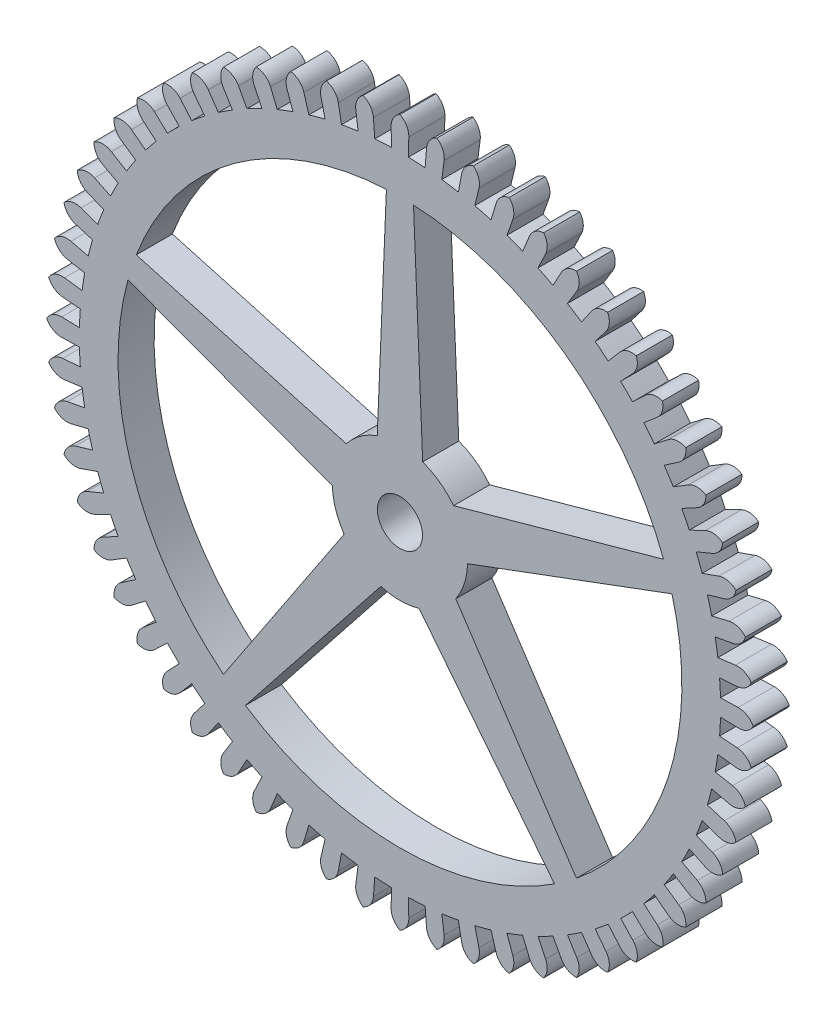
from build123d import *

# Parameters (mm, degrees)
SKETCH1_R           = 0.5
BOSS_EXTRUDE5_DEPTH = 0.8


with BuildPart() as part:
    # Sketch1 → Boss-Extrude5 (new body)
    with BuildSketch(Plane.XY):
        with BuildLine():
            ThreePointArc((-0.196333177, -7.497429779), (-0.145952932, -7.692216353), (0, -7.8307))
            ThreePointArc((0, -7.8307), (0.145952932, -7.692216353), (0.196333177, -7.497429779))
            Line((0.196333177, -7.497429779), (0.186053172, -7.104864355))
            ThreePointArc((0.186053172, -7.104864355), (0.371967342, -7.097559692), (0.5576266, -7.085391017))
            Line((0.5576266, -7.085391017), (0.58843717, -7.476880479))
            ThreePointArc((0.58843717, -7.476880479), (0.658902168, -7.665333823), (0.818531037, -7.787802606))
            ThreePointArc((0.818531037, -7.787802606), (0.949208941, -7.634821352), (0.978952457, -7.435835668))
            Line((0.978952457, -7.435835668), (0.927694506, -7.046495313))
            ThreePointArc((0.927694506, -7.046495313), (1.111826673, -7.019797343), (1.295196897, -6.988288652))
            Line((1.295196897, -6.988288652), (1.366760476, -7.374412912))
            ThreePointArc((1.366760476, -7.374412912), (1.456538198, -7.554468291), (1.628094077, -7.659580417))
            ThreePointArc((1.628094077, -7.659580417), (1.742065219, -7.493777649), (1.750846128, -7.292772987))
            Line((1.750846128, -7.292772987), (1.659171825, -6.910923393))
            ThreePointArc((1.659171825, -6.910923393), (1.839504599, -6.865124625), (2.018576747, -6.814621135))
            Line((2.018576747, -6.814621135), (2.130109268, -7.191149735))
            ThreePointArc((2.130109268, -7.191149735), (2.23821609, -7.360834424), (2.419819378, -7.447438262))
            ThreePointArc((2.419819378, -7.447438262), (2.515835065, -7.270630551), (2.503557163, -7.069809158))
            Line((2.503557163, -7.069809158), (2.37247091, -6.69963395))
            ThreePointArc((2.37247091, -6.69963395), (2.547028528, -6.635236165), (2.719840647, -6.566291202))
            Line((2.719840647, -6.566291202), (2.870120138, -6.929098816))
            ThreePointArc((2.870120138, -6.929098816), (2.995371619, -7.086553715), (3.185032631, -7.153700415))
            ThreePointArc((3.185032631, -7.153700415), (3.262040896, -6.967824903), (3.228838702, -6.769387021))
            Line((3.228838702, -6.769387021), (3.059776708, -6.414941916))
            ThreePointArc((3.059776708, -6.414941916), (3.226646679, -6.332650669), (3.391305404, -6.246019608))
            Line((3.391305404, -6.246019608), (3.57868537, -6.59113124))
            ThreePointArc((3.57868537, -6.59113124), (3.71970923, -6.73463124), (3.91535, -6.781585129))
            ThreePointArc((3.91535, -6.781585129), (3.972507124, -6.588678307), (3.918744408, -6.394798063))
            Line((3.918744408, -6.394798063), (3.713558951, -6.059966436))
            ThreePointArc((3.713558951, -6.059966436), (3.870913014, -5.960683328), (4.02561431, -5.857315317))
            Line((4.02561431, -5.857315317), (4.248041777, -6.180949851))
            ThreePointArc((4.248041777, -6.180949851), (4.403292927, -6.308922735), (4.602769975, -6.335169378))
            ThreePointArc((4.602769975, -6.335169378), (4.639449733, -6.137344773), (4.565715531, -5.950146359))
            Line((4.565715531, -5.950146359), (4.326654666, -5.638596696))
            ThreePointArc((4.326654666, -5.638596696), (4.472768815, -5.523409492), (4.615817742, -5.404437053))
            Line((4.615817742, -5.404437053), (4.870855749, -5.703048682))
            ThreePointArc((4.870855749, -5.703048682), (5.038633226, -5.814092354), (5.239761039, -5.819344185))
            ThreePointArc((5.239761039, -5.819344185), (5.255561559, -5.618769205), (5.162663719, -5.440303606))
            Line((5.162663719, -5.440303606), (4.892346646, -5.15544931))
            ThreePointArc((4.892346646, -5.15544931), (5.025620026, -5.025620026), (5.15544931, -4.892346646))
            Line((5.15544931, -4.892346646), (5.440303606, -5.162663719))
            ThreePointArc((5.440303606, -5.162663719), (5.618769205, -5.255561559), (5.819344185, -5.239761039))
            ThreePointArc((5.819344185, -5.239761039), (5.814092354, -5.038633226), (5.703048682, -4.870855749))
            Line((5.703048682, -4.870855749), (5.404437053, -4.615817742))
            ThreePointArc((5.404437053, -4.615817742), (5.523409492, -4.472768815), (5.638596696, -4.326654666))
            Line((5.638596696, -4.326654666), (5.950146359, -4.565715531))
            ThreePointArc((5.950146359, -4.565715531), (6.137344773, -4.639449733), (6.335169378, -4.602769975))
            ThreePointArc((6.335169378, -4.602769975), (6.308922735, -4.403292927), (6.180949851, -4.248041777))
            Line((6.180949851, -4.248041777), (5.857315317, -4.02561431))
            ThreePointArc((5.857315317, -4.02561431), (5.960683328, -3.870913014), (6.059966436, -3.713558951))
            Line((6.059966436, -3.713558951), (6.394798063, -3.918744408))
            ThreePointArc((6.394798063, -3.918744408), (6.588678307, -3.972507124), (6.781585129, -3.91535))
            ThreePointArc((6.781585129, -3.91535), (6.73463124, -3.71970923), (6.59113124, -3.57868537))
            Line((6.59113124, -3.57868537), (6.246019608, -3.391305404))
            ThreePointArc((6.246019608, -3.391305404), (6.332650669, -3.226646679), (6.414941916, -3.059776708))
            Line((6.414941916, -3.059776708), (6.769387021, -3.228838702))
            ThreePointArc((6.769387021, -3.228838702), (6.967824903, -3.262040896), (7.153700415, -3.185032631))
            ThreePointArc((7.153700415, -3.185032631), (7.086553715, -2.995371619), (6.929098816, -2.870120138))
            Line((6.929098816, -2.870120138), (6.566291202, -2.719840647))
            ThreePointArc((6.566291202, -2.719840647), (6.635236165, -2.547028528), (6.69963395, -2.37247091))
            Line((6.69963395, -2.37247091), (7.069809158, -2.503557163))
            ThreePointArc((7.069809158, -2.503557163), (7.270630551, -2.515835065), (7.447438262, -2.419819378))
            ThreePointArc((7.447438262, -2.419819378), (7.360834424, -2.23821609), (7.191149735, -2.130109268))
            Line((7.191149735, -2.130109268), (6.814621135, -2.018576747))
            ThreePointArc((6.814621135, -2.018576747), (6.865124625, -1.839504599), (6.910923393, -1.659171825))
            Line((6.910923393, -1.659171825), (7.292772987, -1.750846128))
            ThreePointArc((7.292772987, -1.750846128), (7.493777649, -1.742065219), (7.659580417, -1.628094077))
            ThreePointArc((7.659580417, -1.628094077), (7.554468291, -1.456538198), (7.374412912, -1.366760476))
            Line((7.374412912, -1.366760476), (6.988288652, -1.295196897))
            ThreePointArc((6.988288652, -1.295196897), (7.019797343, -1.111826673), (7.046495313, -0.927694506))
            Line((7.046495313, -0.927694506), (7.435835668, -0.978952457))
            ThreePointArc((7.435835668, -0.978952457), (7.634821352, -0.949208941), (7.787802606, -0.818531037))
            ThreePointArc((7.787802606, -0.818531037), (7.665333823, -0.658902168), (7.476880479, -0.58843717))
            Line((7.476880479, -0.58843717), (7.085391017, -0.5576266))
            ThreePointArc((7.085391017, -0.5576266), (7.097559692, -0.371967342), (7.104864355, -0.186053172))
            Line((7.104864355, -0.186053172), (7.497429779, -0.196333177))
            ThreePointArc((7.497429779, -0.196333177), (7.692216353, -0.145952932), (7.8307, 0))
            ThreePointArc((7.8307, 0), (7.692216353, 0.145952932), (7.497429779, 0.196333177))
            Line((7.497429779, 0.196333177), (7.104864355, 0.186053172))
            ThreePointArc((7.104864355, 0.186053172), (7.097559692, 0.371967342), (7.085391017, 0.5576266))
            Line((7.085391017, 0.5576266), (7.476880479, 0.58843717))
            ThreePointArc((7.476880479, 0.58843717), (7.665333823, 0.658902168), (7.787802606, 0.818531037))
            ThreePointArc((7.787802606, 0.818531037), (7.634821352, 0.949208941), (7.435835668, 0.978952457))
            Line((7.435835668, 0.978952457), (7.046495313, 0.927694506))
            ThreePointArc((7.046495313, 0.927694506), (7.019797343, 1.111826673), (6.988288652, 1.295196897))
            Line((6.988288652, 1.295196897), (7.374412912, 1.366760476))
            ThreePointArc((7.374412912, 1.366760476), (7.554468291, 1.456538198), (7.659580417, 1.628094077))
            ThreePointArc((7.659580417, 1.628094077), (7.493777649, 1.742065219), (7.292772987, 1.750846128))
            Line((7.292772987, 1.750846128), (6.910923393, 1.659171825))
            ThreePointArc((6.910923393, 1.659171825), (6.865124625, 1.839504599), (6.814621135, 2.018576747))
            Line((6.814621135, 2.018576747), (7.191149735, 2.130109268))
            ThreePointArc((7.191149735, 2.130109268), (7.360834424, 2.23821609), (7.447438262, 2.419819378))
            ThreePointArc((7.447438262, 2.419819378), (7.270630551, 2.515835065), (7.069809158, 2.503557163))
            Line((7.069809158, 2.503557163), (6.69963395, 2.37247091))
            ThreePointArc((6.69963395, 2.37247091), (6.635236165, 2.547028528), (6.566291202, 2.719840647))
            Line((6.566291202, 2.719840647), (6.929098816, 2.870120138))
            ThreePointArc((6.929098816, 2.870120138), (7.086553715, 2.995371619), (7.153700415, 3.185032631))
            ThreePointArc((7.153700415, 3.185032631), (6.967824903, 3.262040896), (6.769387021, 3.228838702))
            Line((6.769387021, 3.228838702), (6.414941916, 3.059776708))
            ThreePointArc((6.414941916, 3.059776708), (6.332650669, 3.226646679), (6.246019608, 3.391305404))
            Line((6.246019608, 3.391305404), (6.59113124, 3.57868537))
            ThreePointArc((6.59113124, 3.57868537), (6.73463124, 3.71970923), (6.781585129, 3.91535))
            ThreePointArc((6.781585129, 3.91535), (6.588678307, 3.972507124), (6.394798063, 3.918744408))
            Line((6.394798063, 3.918744408), (6.059966436, 3.713558951))
            ThreePointArc((6.059966436, 3.713558951), (5.960683328, 3.870913014), (5.857315317, 4.02561431))
            Line((5.857315317, 4.02561431), (6.180949851, 4.248041777))
            ThreePointArc((6.180949851, 4.248041777), (6.308922735, 4.403292927), (6.335169378, 4.602769975))
            ThreePointArc((6.335169378, 4.602769975), (6.137344773, 4.639449733), (5.950146359, 4.565715531))
            Line((5.950146359, 4.565715531), (5.638596696, 4.326654666))
            ThreePointArc((5.638596696, 4.326654666), (5.523409492, 4.472768815), (5.404437053, 4.615817742))
            Line((5.404437053, 4.615817742), (5.703048682, 4.870855749))
            ThreePointArc((5.703048682, 4.870855749), (5.814092354, 5.038633226), (5.819344185, 5.239761039))
            ThreePointArc((5.819344185, 5.239761039), (5.618769205, 5.255561559), (5.440303606, 5.162663719))
            Line((5.440303606, 5.162663719), (5.15544931, 4.892346646))
            ThreePointArc((5.15544931, 4.892346646), (5.025620026, 5.025620026), (4.892346646, 5.15544931))
            Line((4.892346646, 5.15544931), (5.162663719, 5.440303606))
            ThreePointArc((5.162663719, 5.440303606), (5.255561559, 5.618769205), (5.239761039, 5.819344185))
            ThreePointArc((5.239761039, 5.819344185), (5.038633226, 5.814092354), (4.870855749, 5.703048682))
            Line((4.870855749, 5.703048682), (4.615817742, 5.404437053))
            ThreePointArc((4.615817742, 5.404437053), (4.472768815, 5.523409492), (4.326654666, 5.638596696))
            Line((4.326654666, 5.638596696), (4.565715531, 5.950146359))
            ThreePointArc((4.565715531, 5.950146359), (4.639449733, 6.137344773), (4.602769975, 6.335169378))
            ThreePointArc((4.602769975, 6.335169378), (4.403292927, 6.308922735), (4.248041777, 6.180949851))
            Line((4.248041777, 6.180949851), (4.02561431, 5.857315317))
            ThreePointArc((4.02561431, 5.857315317), (3.870913014, 5.960683328), (3.713558951, 6.059966436))
            Line((3.713558951, 6.059966436), (3.918744408, 6.394798063))
            ThreePointArc((3.918744408, 6.394798063), (3.972507124, 6.588678307), (3.91535, 6.781585129))
            ThreePointArc((3.91535, 6.781585129), (3.71970923, 6.73463124), (3.57868537, 6.59113124))
            Line((3.57868537, 6.59113124), (3.391305404, 6.246019608))
            ThreePointArc((3.391305404, 6.246019608), (3.226646679, 6.332650669), (3.059776708, 6.414941916))
            Line((3.059776708, 6.414941916), (3.228838702, 6.769387021))
            ThreePointArc((3.228838702, 6.769387021), (3.262040896, 6.967824903), (3.185032631, 7.153700415))
            ThreePointArc((3.185032631, 7.153700415), (2.995371619, 7.086553715), (2.870120138, 6.929098816))
            Line((2.870120138, 6.929098816), (2.719840647, 6.566291202))
            ThreePointArc((2.719840647, 6.566291202), (2.547028528, 6.635236165), (2.37247091, 6.69963395))
            Line((2.37247091, 6.69963395), (2.503557163, 7.069809158))
            ThreePointArc((2.503557163, 7.069809158), (2.515835065, 7.270630551), (2.419819378, 7.447438262))
            ThreePointArc((2.419819378, 7.447438262), (2.23821609, 7.360834424), (2.130109268, 7.191149735))
            Line((2.130109268, 7.191149735), (2.018576747, 6.814621135))
            ThreePointArc((2.018576747, 6.814621135), (1.839504599, 6.865124625), (1.659171825, 6.910923393))
            Line((1.659171825, 6.910923393), (1.750846128, 7.292772987))
            ThreePointArc((1.750846128, 7.292772987), (1.742065219, 7.493777649), (1.628094077, 7.659580417))
            ThreePointArc((1.628094077, 7.659580417), (1.456538198, 7.554468291), (1.366760476, 7.374412912))
            Line((1.366760476, 7.374412912), (1.295196897, 6.988288652))
            ThreePointArc((1.295196897, 6.988288652), (1.111826673, 7.019797343), (0.927694506, 7.046495313))
            Line((0.927694506, 7.046495313), (0.978952457, 7.435835668))
            ThreePointArc((0.978952457, 7.435835668), (0.949208941, 7.634821352), (0.818531037, 7.787802606))
            ThreePointArc((0.818531037, 7.787802606), (0.658902168, 7.665333823), (0.58843717, 7.476880479))
            Line((0.58843717, 7.476880479), (0.5576266, 7.085391017))
            ThreePointArc((0.5576266, 7.085391017), (0.371967342, 7.097559692), (0.186053172, 7.104864355))
            Line((0.186053172, 7.104864355), (0.196333177, 7.497429779))
            ThreePointArc((0.196333177, 7.497429779), (0.145952932, 7.692216353), (0, 7.8307))
            ThreePointArc((0, 7.8307), (-0.145952932, 7.692216353), (-0.196333177, 7.497429779))
            Line((-0.196333177, 7.497429779), (-0.186053172, 7.104864355))
            ThreePointArc((-0.186053172, 7.104864355), (-0.371967342, 7.097559692), (-0.5576266, 7.085391017))
            Line((-0.5576266, 7.085391017), (-0.58843717, 7.476880479))
            ThreePointArc((-0.58843717, 7.476880479), (-0.658902168, 7.665333823), (-0.818531037, 7.787802606))
            ThreePointArc((-0.818531037, 7.787802606), (-0.949208941, 7.634821352), (-0.978952457, 7.435835668))
            Line((-0.978952457, 7.435835668), (-0.927694506, 7.046495313))
            ThreePointArc((-0.927694506, 7.046495313), (-1.111826673, 7.019797343), (-1.295196897, 6.988288652))
            Line((-1.295196897, 6.988288652), (-1.366760476, 7.374412912))
            ThreePointArc((-1.366760476, 7.374412912), (-1.456538198, 7.554468291), (-1.628094077, 7.659580417))
            ThreePointArc((-1.628094077, 7.659580417), (-1.742065219, 7.493777649), (-1.750846128, 7.292772987))
            Line((-1.750846128, 7.292772987), (-1.659171825, 6.910923393))
            ThreePointArc((-1.659171825, 6.910923393), (-1.839504599, 6.865124625), (-2.018576747, 6.814621135))
            Line((-2.018576747, 6.814621135), (-2.130109268, 7.191149735))
            ThreePointArc((-2.130109268, 7.191149735), (-2.23821609, 7.360834424), (-2.419819378, 7.447438262))
            ThreePointArc((-2.419819378, 7.447438262), (-2.515835065, 7.270630551), (-2.503557163, 7.069809158))
            Line((-2.503557163, 7.069809158), (-2.37247091, 6.69963395))
            ThreePointArc((-2.37247091, 6.69963395), (-2.547028528, 6.635236165), (-2.719840647, 6.566291202))
            Line((-2.719840647, 6.566291202), (-2.870120138, 6.929098816))
            ThreePointArc((-2.870120138, 6.929098816), (-2.995371619, 7.086553715), (-3.185032631, 7.153700415))
            ThreePointArc((-3.185032631, 7.153700415), (-3.262040896, 6.967824903), (-3.228838702, 6.769387021))
            Line((-3.228838702, 6.769387021), (-3.059776708, 6.414941916))
            ThreePointArc((-3.059776708, 6.414941916), (-3.226646679, 6.332650669), (-3.391305404, 6.246019608))
            Line((-3.391305404, 6.246019608), (-3.57868537, 6.59113124))
            ThreePointArc((-3.57868537, 6.59113124), (-3.71970923, 6.73463124), (-3.91535, 6.781585129))
            ThreePointArc((-3.91535, 6.781585129), (-3.972507124, 6.588678307), (-3.918744408, 6.394798063))
            Line((-3.918744408, 6.394798063), (-3.713558951, 6.059966436))
            ThreePointArc((-3.713558951, 6.059966436), (-3.870913014, 5.960683328), (-4.02561431, 5.857315317))
            Line((-4.02561431, 5.857315317), (-4.248041777, 6.180949851))
            ThreePointArc((-4.248041777, 6.180949851), (-4.403292927, 6.308922735), (-4.602769975, 6.335169378))
            ThreePointArc((-4.602769975, 6.335169378), (-4.639449733, 6.137344773), (-4.565715531, 5.950146359))
            Line((-4.565715531, 5.950146359), (-4.326654666, 5.638596696))
            ThreePointArc((-4.326654666, 5.638596696), (-4.472768815, 5.523409492), (-4.615817742, 5.404437053))
            Line((-4.615817742, 5.404437053), (-4.870855749, 5.703048682))
            ThreePointArc((-4.870855749, 5.703048682), (-5.038633226, 5.814092354), (-5.239761039, 5.819344185))
            ThreePointArc((-5.239761039, 5.819344185), (-5.255561559, 5.618769205), (-5.162663719, 5.440303606))
            Line((-5.162663719, 5.440303606), (-4.892346646, 5.15544931))
            ThreePointArc((-4.892346646, 5.15544931), (-5.025620026, 5.025620026), (-5.15544931, 4.892346646))
            Line((-5.15544931, 4.892346646), (-5.440303606, 5.162663719))
            ThreePointArc((-5.440303606, 5.162663719), (-5.618769205, 5.255561559), (-5.819344185, 5.239761039))
            ThreePointArc((-5.819344185, 5.239761039), (-5.814092354, 5.038633226), (-5.703048682, 4.870855749))
            Line((-5.703048682, 4.870855749), (-5.404437053, 4.615817742))
            ThreePointArc((-5.404437053, 4.615817742), (-5.523409492, 4.472768815), (-5.638596696, 4.326654666))
            Line((-5.638596696, 4.326654666), (-5.950146359, 4.565715531))
            ThreePointArc((-5.950146359, 4.565715531), (-6.137344773, 4.639449733), (-6.335169378, 4.602769975))
            ThreePointArc((-6.335169378, 4.602769975), (-6.308922735, 4.403292927), (-6.180949851, 4.248041777))
            Line((-6.180949851, 4.248041777), (-5.857315317, 4.02561431))
            ThreePointArc((-5.857315317, 4.02561431), (-5.960683328, 3.870913014), (-6.059966436, 3.713558951))
            Line((-6.059966436, 3.713558951), (-6.394798063, 3.918744408))
            ThreePointArc((-6.394798063, 3.918744408), (-6.588678307, 3.972507124), (-6.781585129, 3.91535))
            ThreePointArc((-6.781585129, 3.91535), (-6.73463124, 3.71970923), (-6.59113124, 3.57868537))
            Line((-6.59113124, 3.57868537), (-6.246019608, 3.391305404))
            ThreePointArc((-6.246019608, 3.391305404), (-6.332650669, 3.226646679), (-6.414941916, 3.059776708))
            Line((-6.414941916, 3.059776708), (-6.769387021, 3.228838702))
            ThreePointArc((-6.769387021, 3.228838702), (-6.967824903, 3.262040896), (-7.153700415, 3.185032631))
            ThreePointArc((-7.153700415, 3.185032631), (-7.086553715, 2.995371619), (-6.929098816, 2.870120138))
            Line((-6.929098816, 2.870120138), (-6.566291202, 2.719840647))
            ThreePointArc((-6.566291202, 2.719840647), (-6.635236165, 2.547028528), (-6.69963395, 2.37247091))
            Line((-6.69963395, 2.37247091), (-7.069809158, 2.503557163))
            ThreePointArc((-7.069809158, 2.503557163), (-7.270630551, 2.515835065), (-7.447438262, 2.419819378))
            ThreePointArc((-7.447438262, 2.419819378), (-7.360834424, 2.23821609), (-7.191149735, 2.130109268))
            Line((-7.191149735, 2.130109268), (-6.814621135, 2.018576747))
            ThreePointArc((-6.814621135, 2.018576747), (-6.865124625, 1.839504599), (-6.910923393, 1.659171825))
            Line((-6.910923393, 1.659171825), (-7.292772987, 1.750846128))
            ThreePointArc((-7.292772987, 1.750846128), (-7.493777649, 1.742065219), (-7.659580417, 1.628094077))
            ThreePointArc((-7.659580417, 1.628094077), (-7.554468291, 1.456538198), (-7.374412912, 1.366760476))
            Line((-7.374412912, 1.366760476), (-6.988288652, 1.295196897))
            ThreePointArc((-6.988288652, 1.295196897), (-7.019797343, 1.111826673), (-7.046495313, 0.927694506))
            Line((-7.046495313, 0.927694506), (-7.435835668, 0.978952457))
            ThreePointArc((-7.435835668, 0.978952457), (-7.634821352, 0.949208941), (-7.787802606, 0.818531037))
            ThreePointArc((-7.787802606, 0.818531037), (-7.665333823, 0.658902168), (-7.476880479, 0.58843717))
            Line((-7.476880479, 0.58843717), (-7.085391017, 0.5576266))
            ThreePointArc((-7.085391017, 0.5576266), (-7.097559692, 0.371967342), (-7.104864355, 0.186053172))
            Line((-7.104864355, 0.186053172), (-7.497429779, 0.196333177))
            ThreePointArc((-7.497429779, 0.196333177), (-7.692216353, 0.145952932), (-7.8307, 0))
            ThreePointArc((-7.8307, 0), (-7.692216353, -0.145952932), (-7.497429779, -0.196333177))
            Line((-7.497429779, -0.196333177), (-7.104864355, -0.186053172))
            ThreePointArc((-7.104864355, -0.186053172), (-7.097559692, -0.371967342), (-7.085391017, -0.5576266))
            Line((-7.085391017, -0.5576266), (-7.476880479, -0.58843717))
            ThreePointArc((-7.476880479, -0.58843717), (-7.665333823, -0.658902168), (-7.787802606, -0.818531037))
            ThreePointArc((-7.787802606, -0.818531037), (-7.634821352, -0.949208941), (-7.435835668, -0.978952457))
            Line((-7.435835668, -0.978952457), (-7.046495313, -0.927694506))
            ThreePointArc((-7.046495313, -0.927694506), (-7.019797343, -1.111826673), (-6.988288652, -1.295196897))
            Line((-6.988288652, -1.295196897), (-7.374412912, -1.366760476))
            ThreePointArc((-7.374412912, -1.366760476), (-7.554468291, -1.456538198), (-7.659580417, -1.628094077))
            ThreePointArc((-7.659580417, -1.628094077), (-7.493777649, -1.742065219), (-7.292772987, -1.750846128))
            Line((-7.292772987, -1.750846128), (-6.910923393, -1.659171825))
            ThreePointArc((-6.910923393, -1.659171825), (-6.865124625, -1.839504599), (-6.814621135, -2.018576747))
            Line((-6.814621135, -2.018576747), (-7.191149735, -2.130109268))
            ThreePointArc((-7.191149735, -2.130109268), (-7.360834424, -2.23821609), (-7.447438262, -2.419819378))
            ThreePointArc((-7.447438262, -2.419819378), (-7.270630551, -2.515835065), (-7.069809158, -2.503557163))
            Line((-7.069809158, -2.503557163), (-6.69963395, -2.37247091))
            ThreePointArc((-6.69963395, -2.37247091), (-6.635236165, -2.547028528), (-6.566291202, -2.719840647))
            Line((-6.566291202, -2.719840647), (-6.929098816, -2.870120138))
            ThreePointArc((-6.929098816, -2.870120138), (-7.086553715, -2.995371619), (-7.153700415, -3.185032631))
            ThreePointArc((-7.153700415, -3.185032631), (-6.967824903, -3.262040896), (-6.769387021, -3.228838702))
            Line((-6.769387021, -3.228838702), (-6.414941916, -3.059776708))
            ThreePointArc((-6.414941916, -3.059776708), (-6.332650669, -3.226646679), (-6.246019608, -3.391305404))
            Line((-6.246019608, -3.391305404), (-6.59113124, -3.57868537))
            ThreePointArc((-6.59113124, -3.57868537), (-6.73463124, -3.71970923), (-6.781585129, -3.91535))
            ThreePointArc((-6.781585129, -3.91535), (-6.588678307, -3.972507124), (-6.394798063, -3.918744408))
            Line((-6.394798063, -3.918744408), (-6.059966436, -3.713558951))
            ThreePointArc((-6.059966436, -3.713558951), (-5.960683328, -3.870913014), (-5.857315317, -4.02561431))
            Line((-5.857315317, -4.02561431), (-6.180949851, -4.248041777))
            ThreePointArc((-6.180949851, -4.248041777), (-6.308922735, -4.403292927), (-6.335169378, -4.602769975))
            ThreePointArc((-6.335169378, -4.602769975), (-6.137344773, -4.639449733), (-5.950146359, -4.565715531))
            Line((-5.950146359, -4.565715531), (-5.638596696, -4.326654666))
            ThreePointArc((-5.638596696, -4.326654666), (-5.523409492, -4.472768815), (-5.404437053, -4.615817742))
            Line((-5.404437053, -4.615817742), (-5.703048682, -4.870855749))
            ThreePointArc((-5.703048682, -4.870855749), (-5.814092354, -5.038633226), (-5.819344185, -5.239761039))
            ThreePointArc((-5.819344185, -5.239761039), (-5.618769205, -5.255561559), (-5.440303606, -5.162663719))
            Line((-5.440303606, -5.162663719), (-5.15544931, -4.892346646))
            ThreePointArc((-5.15544931, -4.892346646), (-5.025620026, -5.025620026), (-4.892346646, -5.15544931))
            Line((-4.892346646, -5.15544931), (-5.162663719, -5.440303606))
            ThreePointArc((-5.162663719, -5.440303606), (-5.255561559, -5.618769205), (-5.239761039, -5.819344185))
            ThreePointArc((-5.239761039, -5.819344185), (-5.038633226, -5.814092354), (-4.870855749, -5.703048682))
            Line((-4.870855749, -5.703048682), (-4.615817742, -5.404437053))
            ThreePointArc((-4.615817742, -5.404437053), (-4.472768815, -5.523409492), (-4.326654666, -5.638596696))
            Line((-4.326654666, -5.638596696), (-4.565715531, -5.950146359))
            ThreePointArc((-4.565715531, -5.950146359), (-4.639449733, -6.137344773), (-4.602769975, -6.335169378))
            ThreePointArc((-4.602769975, -6.335169378), (-4.403292927, -6.308922735), (-4.248041777, -6.180949851))
            Line((-4.248041777, -6.180949851), (-4.02561431, -5.857315317))
            ThreePointArc((-4.02561431, -5.857315317), (-3.870913014, -5.960683328), (-3.713558951, -6.059966436))
            Line((-3.713558951, -6.059966436), (-3.918744408, -6.394798063))
            ThreePointArc((-3.918744408, -6.394798063), (-3.972507124, -6.588678307), (-3.91535, -6.781585129))
            ThreePointArc((-3.91535, -6.781585129), (-3.71970923, -6.73463124), (-3.57868537, -6.59113124))
            Line((-3.57868537, -6.59113124), (-3.391305404, -6.246019608))
            ThreePointArc((-3.391305404, -6.246019608), (-3.226646679, -6.332650669), (-3.059776708, -6.414941916))
            Line((-3.059776708, -6.414941916), (-3.228838702, -6.769387021))
            ThreePointArc((-3.228838702, -6.769387021), (-3.262040896, -6.967824903), (-3.185032631, -7.153700415))
            ThreePointArc((-3.185032631, -7.153700415), (-2.995371619, -7.086553715), (-2.870120138, -6.929098816))
            Line((-2.870120138, -6.929098816), (-2.719840647, -6.566291202))
            ThreePointArc((-2.719840647, -6.566291202), (-2.547028528, -6.635236165), (-2.37247091, -6.69963395))
            Line((-2.37247091, -6.69963395), (-2.503557163, -7.069809158))
            ThreePointArc((-2.503557163, -7.069809158), (-2.515835065, -7.270630551), (-2.419819378, -7.447438262))
            ThreePointArc((-2.419819378, -7.447438262), (-2.23821609, -7.360834424), (-2.130109268, -7.191149735))
            Line((-2.130109268, -7.191149735), (-2.018576747, -6.814621135))
            ThreePointArc((-2.018576747, -6.814621135), (-1.839504599, -6.865124625), (-1.659171825, -6.910923393))
            Line((-1.659171825, -6.910923393), (-1.750846128, -7.292772987))
            ThreePointArc((-1.750846128, -7.292772987), (-1.742065219, -7.493777649), (-1.628094077, -7.659580417))
            ThreePointArc((-1.628094077, -7.659580417), (-1.456538198, -7.554468291), (-1.366760476, -7.374412912))
            Line((-1.366760476, -7.374412912), (-1.295196897, -6.988288652))
            ThreePointArc((-1.295196897, -6.988288652), (-1.111826673, -7.019797343), (-0.927694506, -7.046495313))
            Line((-0.927694506, -7.046495313), (-0.978952457, -7.435835668))
            ThreePointArc((-0.978952457, -7.435835668), (-0.949208941, -7.634821352), (-0.818531037, -7.787802606))
            ThreePointArc((-0.818531037, -7.787802606), (-0.658902168, -7.665333823), (-0.58843717, -7.476880479))
            Line((-0.58843717, -7.476880479), (-0.5576266, -7.085391017))
            ThreePointArc((-0.5576266, -7.085391017), (-0.371967342, -7.097559692), (-0.186053172, -7.104864355))
            Line((-0.186053172, -7.104864355), (-0.196333177, -7.497429779))
        make_face()
        with BuildLine():
            ThreePointArc((-3.91236574, -4.874001879), (-5.944103227, -1.931356215), (-6.030036796, 1.643519467))
            Line((-6.030036796, 1.643519467), (-1.499400573, -0.042401912))
            ThreePointArc((-1.499400573, -0.042401912), (-1.426584774, -0.463525492), (-1.237963763, -0.847021677))
            Line((-1.237963763, -0.847021677), (-3.91236574, -4.874001879))
        make_face(mode=Mode.SUBTRACT)
        with BuildLine():
            ThreePointArc((3.426463745, -5.227030343), (0, -6.25), (-3.426463745, -5.227030343))
            Line((-3.426463745, -5.227030343), (-0.423013644, -1.439117597))
            ThreePointArc((-0.423013644, -1.439117597), (0, -1.5), (0.423013644, -1.439117597))
            Line((0.423013644, -1.439117597), (3.426463745, -5.227030343))
        make_face(mode=Mode.SUBTRACT)
        with BuildLine():
            ThreePointArc((-5.844438749, 2.21473152), (-3.673657827, 5.056356215), (-0.300303948, 6.242781234))
            Line((-0.300303948, 6.242781234), (-0.503666873, 1.412911774))
            ThreePointArc((-0.503666873, 1.412911774), (-0.881677878, 1.213525492), (-1.188117327, 0.915629411))
            Line((-1.188117327, 0.915629411), (-5.844438749, 2.21473152))
        make_face(mode=Mode.SUBTRACT)
        Circle(SKETCH1_R, mode=Mode.SUBTRACT)
        with BuildLine():
            ThreePointArc((0.300303948, 6.242781234), (3.673657827, 5.056356215), (5.844438749, 2.21473152))
            Line((5.844438749, 2.21473152), (1.188117327, 0.915629411))
            ThreePointArc((1.188117327, 0.915629411), (0.881677878, 1.213525492), (0.503666873, 1.412911774))
            Line((0.503666873, 1.412911774), (0.300303948, 6.242781234))
        make_face(mode=Mode.SUBTRACT)
        with BuildLine():
            ThreePointArc((6.030036796, 1.643519467), (5.944103227, -1.931356215), (3.91236574, -4.874001879))
            Line((3.91236574, -4.874001879), (1.237963763, -0.847021677))
            ThreePointArc((1.237963763, -0.847021677), (1.426584774, -0.463525492), (1.499400573, -0.042401912))
            Line((1.499400573, -0.042401912), (6.030036796, 1.643519467))
        make_face(mode=Mode.SUBTRACT)
    extrude(amount=-BOSS_EXTRUDE5_DEPTH)


solid = part.part
